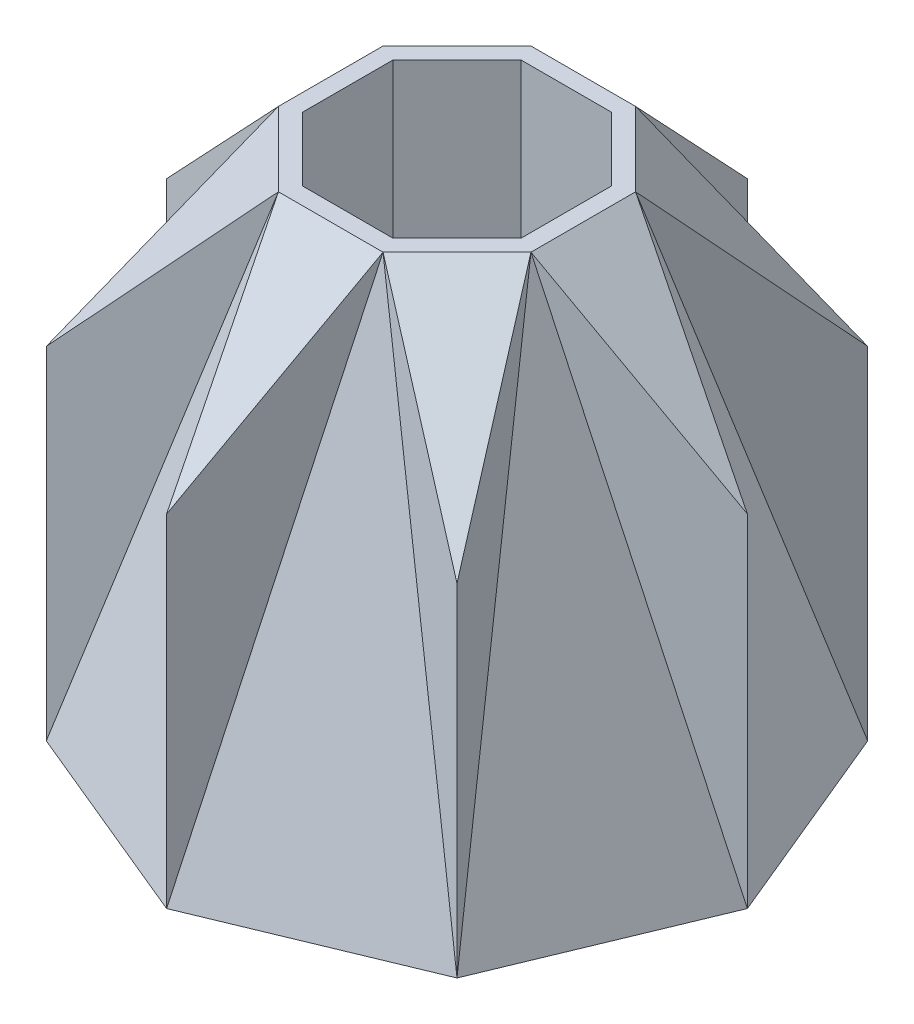
from build123d import *

# Parameters (mm, degrees)
EXTRUDE_1_DEPTH                  = 150
SKETCH_10_W                      = 150
SKETCH_10_H                      = 201.944841161
CUT_EXTRUDE_9_DEPTH              = 232.130644437
PATTERN_CIRCULAR_6_COUNT         = 8
EXTRUDE_6_DEPTH                  = 150
CUT_EXTRUDE_10_REACH             = 194.224
CUT_EXTRUDE_10_DIRECTION_2_REACH = 194.224
PATTERN_CIRCULAR_7_COUNT         = 8
EXTRUDE_7_DEPTH                  = 150


with BuildPart() as part:
    # 草图1 → 凸台-拉伸1 (new body)
    with BuildSketch(Plane(origin=(0, 0, 0), x_dir=(1, 0, 0), z_dir=(0, 1, 0))):
        Polygon((-60.104076401, -60.104076401), (0, -85), (60.104076401, -60.104076401), (85, 0), (60.104076401, 60.104076401), (0, 85), (-60.104076401, 60.104076401), (-85, 0), align=None)
        Polygon((-15.307337295, -36.9551813), (15.307337295, -36.9551813), (36.9551813, -15.307337295), (36.9551813, 15.307337295), (15.307337295, 36.9551813), (-15.307337295, 36.9551813), (-36.9551813, 15.307337295), (-36.9551813, -15.307337295), align=None, mode=Mode.SUBTRACT)
    extrude(amount=EXTRUDE_1_DEPTH)

    # 草图10 → 切除-拉伸9 (cut, through all)
    with BuildSketch(Plane(origin=(-28.191943273, 18.923017893, 68.0613718), x_dir=(0.9287722113346277, 0.09928567118319402, 0.35710577557677253), z_dir=(-0.3706510211136421, 0.2487886640689572, 0.894830722079991))):
        with Locations((13.456718785, 57.315220344)):
            Rectangle(SKETCH_10_W, SKETCH_10_H)
    cut_extrude_9 = extrude(amount=CUT_EXTRUDE_9_DEPTH, mode=Mode.SUBTRACT)

    # 阵列(圆周)6: 切除-拉伸9 ×8 about axis
    pattern_circular_6_axis = Axis((0, 0, 0), (0, 1, 0))
    for i in range(1, PATTERN_CIRCULAR_6_COUNT):
        add(cut_extrude_9.rotate(pattern_circular_6_axis, i * 360 / PATTERN_CIRCULAR_6_COUNT), mode=Mode.SUBTRACT)

    # 草图13 → 凸台-拉伸6 (add, through all)
    with BuildSketch(Plane(origin=(0, 0, 0), x_dir=(1, 0, 0), z_dir=(0, 1, 0))):
        Polygon((-36.9551813, 15.307337295), (-85, 0), (-36.9551813, -15.307337295), align=None)
    extrude_6 = extrude(amount=EXTRUDE_6_DEPTH)

    # 草图14 → 切除-拉伸10 (cut, up to next)
    with BuildSketch(Plane.XY, mode=Mode.PRIVATE) as cut_extrude_10_sk1:
        Polygon((-36.9551813, 150), (-85, 150), (-85, 100), align=None)
    cut_extrude_10_tool1 = extrude(cut_extrude_10_sk1.sketch, amount=-CUT_EXTRUDE_10_REACH, mode=Mode.PRIVATE) & part.part
    cut_extrude_10 = cut_extrude_10_tool1.solids().sort_by_distance((-68.98506, 133.333333, 0))[0]
    add(cut_extrude_10, mode=Mode.SUBTRACT)

    # 草图14 → 切除-拉伸10 direction 2 (cut, up to next)
    with BuildSketch(Plane.XY, mode=Mode.PRIVATE) as cut_extrude_10_direction_2_sk1:
        Polygon((-36.9551813, 150), (-85, 150), (-85, 100), align=None)
    cut_extrude_10_direction_2_tool1 = extrude(cut_extrude_10_direction_2_sk1.sketch, amount=CUT_EXTRUDE_10_DIRECTION_2_REACH, mode=Mode.PRIVATE) & part.part
    cut_extrude_10_direction_2 = cut_extrude_10_direction_2_tool1.solids().sort_by_distance((-68.98506, 133.333333, 0))[0]
    add(cut_extrude_10_direction_2, mode=Mode.SUBTRACT)

    # 阵列(圆周)7: 凸台-拉伸6, 切除-拉伸10, 切除-拉伸10 direction 2 ×8 about axis
    pattern_circular_7_axis = Axis((0, 0, 0), (0, 1, 0))
    add([extrude_6.rotate(pattern_circular_7_axis, i * 360 / PATTERN_CIRCULAR_7_COUNT) for i in range(1, PATTERN_CIRCULAR_7_COUNT)])
    add([cut_extrude_10.rotate(pattern_circular_7_axis, i * 360 / PATTERN_CIRCULAR_7_COUNT) for i in range(1, PATTERN_CIRCULAR_7_COUNT)], mode=Mode.SUBTRACT)
    add([cut_extrude_10_direction_2.rotate(pattern_circular_7_axis, i * 360 / PATTERN_CIRCULAR_7_COUNT) for i in range(1, PATTERN_CIRCULAR_7_COUNT)], mode=Mode.SUBTRACT)

    # 草图1<3> → 凸台-拉伸7 (add)
    with BuildSketch(Plane(origin=(0, 0, 0), x_dir=(1, 0, 0), z_dir=(0, 1, 0))):
        Polygon((-36.9551813, -15.307337295), (-15.307337295, -36.9551813), (15.307337295, -36.9551813), (36.9551813, -15.307337295), (36.9551813, 15.307337295), (15.307337295, 36.9551813), (-15.307337295, 36.9551813), (-36.9551813, 15.307337295), align=None)
        Polygon((13.236269483, 31.9551813), (-13.236269483, 31.9551813), (-31.9551813, 13.236269483), (-31.9551813, -13.236269483), (-13.236269483, -31.9551813), (13.236269483, -31.9551813), (31.9551813, -13.236269483), (31.9551813, 13.236269483), align=None, mode=Mode.SUBTRACT)
    extrude(amount=EXTRUDE_7_DEPTH)


solid = part.part
